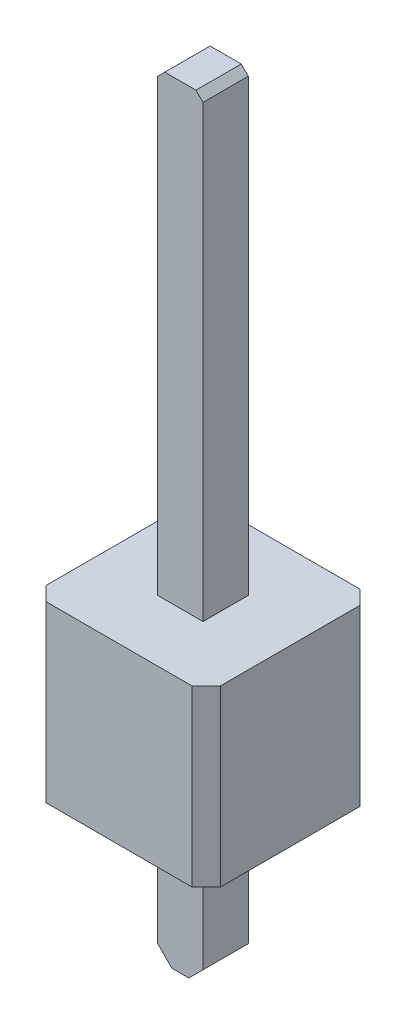
from build123d import *

# Parameters (mm, degrees)
CROQUIS1_W              = 2.46
CROQUIS1_H              = 2.46
SALIENTE_EXTRUIR1_DEPTH = 2.37
CROQUIS2_W              = 0.64
CROQUIS2_H              = 0.64
SALIENTE_EXTRUIR2_DEPTH = 6.45
CROQUIS3_W              = 0.64
CROQUIS3_H              = 0.64
SALIENTE_EXTRUIR3_DEPTH = 2
CHAFL_N1_SIZE           = 0.2
CHAFL_N2_SIZE           = 0.2
CHAFL_N3_SIZE           = 0.2
CHAFL_N4_SIZE           = 0.2
CHAFL_N5_SIZE           = 0.1
CHAFL_N6_SIZE           = 0.1
CHAFL_N7_SIZE           = 0.2
CHAFL_N8_SIZE           = 0.2


with BuildPart() as part:
    # Croquis1 → Saliente-Extruir1 (new body)
    with BuildSketch(Plane.XY):
        with Locations((-36.003107302, -31.574436279)):
            Rectangle(CROQUIS1_W, CROQUIS1_H)
    extrude(amount=SALIENTE_EXTRUIR1_DEPTH)

    # Croquis2 → Saliente-Extruir2 (add)
    with BuildSketch(Plane(origin=(0, -30.344436279, 0), x_dir=(1, 0, 0), z_dir=(0, 1, 0))):
        with Locations((-36.003107302, -1.185)):
            Rectangle(CROQUIS2_W, CROQUIS2_H)
    extrude(amount=SALIENTE_EXTRUIR2_DEPTH)

    # Croquis3 → Saliente-Extruir3 (add)
    with BuildSketch(Plane.XZ.offset(32.804436279)):
        with Locations((-36.003107302, 1.185)):
            Rectangle(CROQUIS3_W, CROQUIS3_H)
    extrude(amount=SALIENTE_EXTRUIR3_DEPTH)

    # Chaflán1
    chafl_n1_edges = [part.edges().sort_by_distance(p)[0] for p in [
        (-37.233107302, -31.574436279, 2.37),
    ]]
    chamfer(chafl_n1_edges, length=CHAFL_N1_SIZE)

    # Chaflán2
    chafl_n2_edges = [part.edges().sort_by_distance(p)[0] for p in [
        (-34.773107302, -31.574436279, 2.37),
    ]]
    chamfer(chafl_n2_edges, length=CHAFL_N2_SIZE)

    # Chaflán3
    chafl_n3_edges = [part.edges().sort_by_distance(p)[0] for p in [
        (-34.773107302, -31.574436279, 0),
    ]]
    chamfer(chafl_n3_edges, length=CHAFL_N3_SIZE)

    # Chaflán4
    chafl_n4_edges = [part.edges().sort_by_distance(p)[0] for p in [
        (-37.233107302, -31.574436279, 0),
    ]]
    chamfer(chafl_n4_edges, length=CHAFL_N4_SIZE)

    # Chaflán5
    chafl_n5_edges = [part.edges().sort_by_distance(p)[0] for p in [
        (-35.683107302, -23.894436279, 1.185),
    ]]
    chamfer(chafl_n5_edges, length=CHAFL_N5_SIZE)

    # Chaflán6
    chafl_n6_edges = [part.edges().sort_by_distance(p)[0] for p in [
        (-36.323107302, -23.894436279, 1.185),
    ]]
    chamfer(chafl_n6_edges, length=CHAFL_N6_SIZE)

    # Chaflán7
    chafl_n7_edges = [part.edges().sort_by_distance(p)[0] for p in [
        (-35.683107302, -34.804436279, 1.185),
    ]]
    chamfer(chafl_n7_edges, length=CHAFL_N7_SIZE)

    # Chaflán8
    chafl_n8_edges = [part.edges().sort_by_distance(p)[0] for p in [
        (-36.323107302, -34.804436279, 1.185),
    ]]
    chamfer(chafl_n8_edges, length=CHAFL_N8_SIZE)


solid = part.part
